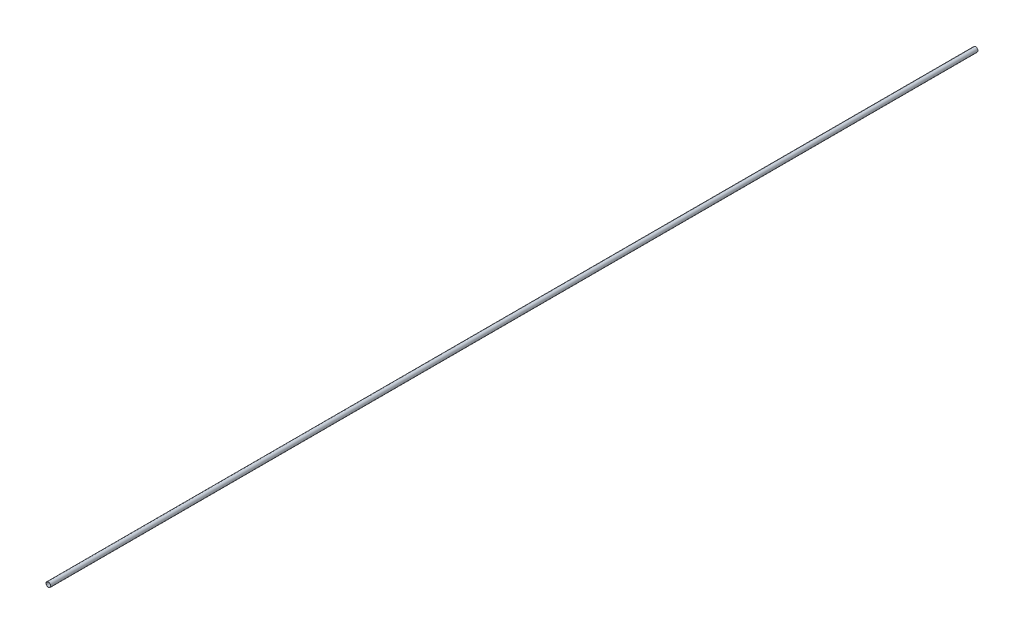
from build123d import *

# Parameters (mm, degrees)
SKETCH1_R           = 3.8862
SKETCH1_R_2         = 3.5306
BOSS_EXTRUDE1_DEPTH = 1524


with BuildPart() as part:
    # Sketch1 → Boss-Extrude1 (new body)
    with BuildSketch(Plane.XY):
        with Locations((2675.105839614, 3025.345964382)):
            Circle(SKETCH1_R)
        with Locations((2675.105839614, 3025.345964382)):
            Circle(SKETCH1_R_2, mode=Mode.SUBTRACT)
    extrude(amount=BOSS_EXTRUDE1_DEPTH)


solid = part.part
